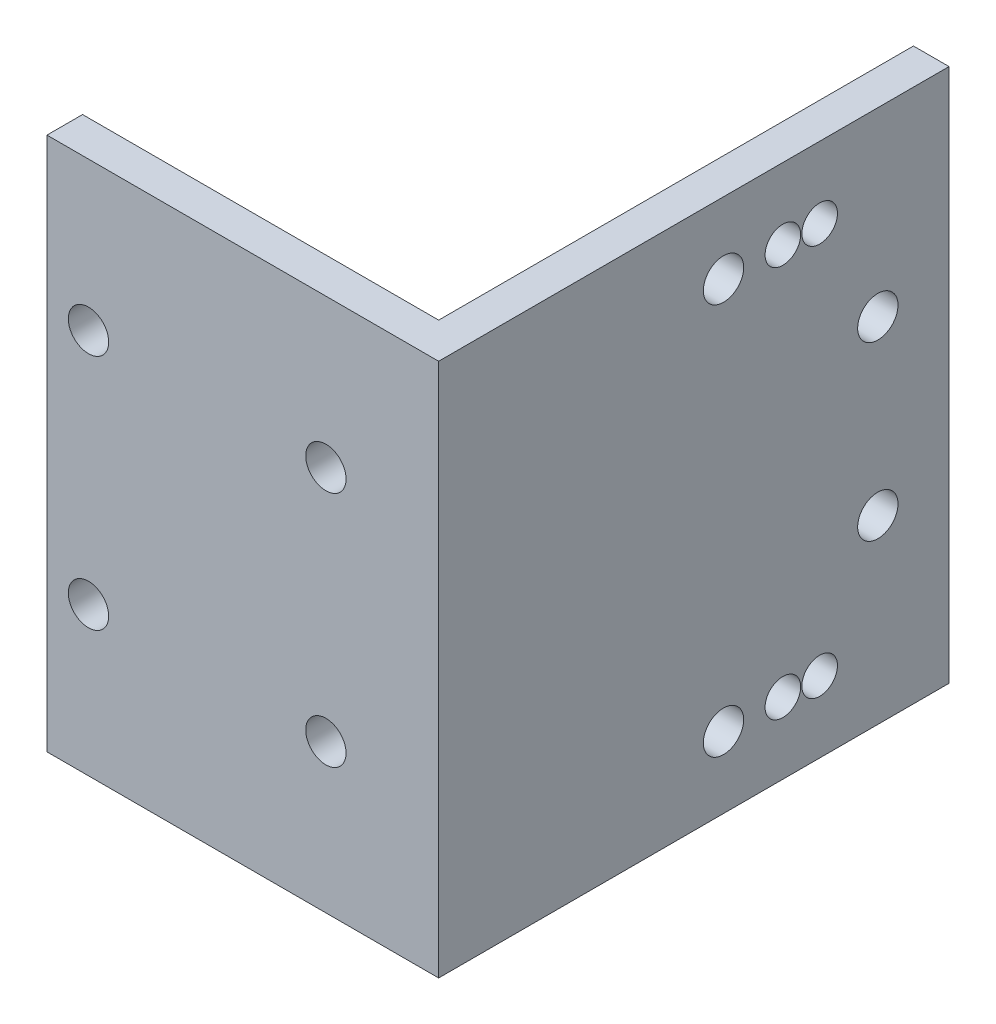
from build123d import *

# Parameters (mm, degrees)
EXTRUDE_1_DEPTH          = 45
CUT_EXTRUDE_1_REACH      = 86.161
SKETCH_2_R               = 1.7
CUT_EXTRUDE_2_REACH      = 83.939
SKETCH_3_R               = 1.7
SKETCH_3_R_2             = 1.5
CUT_EXTRUDE_3_DEPTH      = 81.777472107
CUT_EXTRUDE_3_DEPTH_BACK = 81.777472107


with BuildPart() as part:
    # 草图1 → 凸台-拉伸1 (new body)
    with BuildSketch(Plane(origin=(0, 0, 0), x_dir=(1, 0, 0), z_dir=(0, 1, 0))):
        Polygon((0, 0), (30, 0), (30, 60), (33, 60), (33, -3), (0, -3), align=None)
    extrude(amount=EXTRUDE_1_DEPTH)

    # 草图2 → 切除-拉伸1 (cut, up to next)
    with BuildSketch(Plane.XY.offset(3), mode=Mode.PRIVATE) as cut_extrude_1_sk1:
        with Locations((3.5, 32.5)):
            Circle(SKETCH_2_R)
    cut_extrude_1_tool1 = extrude(cut_extrude_1_sk1.sketch, amount=-CUT_EXTRUDE_1_REACH, mode=Mode.PRIVATE) & part.part
    # 草图2 → 切除-拉伸1 (cut, up to next)
    with BuildSketch(Plane.XY.offset(3), mode=Mode.PRIVATE) as cut_extrude_1_sk2:
        with Locations((23.5, 32.5)):
            Circle(SKETCH_2_R)
    cut_extrude_1_tool2 = extrude(cut_extrude_1_sk2.sketch, amount=-CUT_EXTRUDE_1_REACH, mode=Mode.PRIVATE) & part.part
    # 草图2 → 切除-拉伸1 (cut, up to next)
    with BuildSketch(Plane.XY.offset(3), mode=Mode.PRIVATE) as cut_extrude_1_sk3:
        with Locations((23.5, 12.5)):
            Circle(SKETCH_2_R)
    cut_extrude_1_tool3 = extrude(cut_extrude_1_sk3.sketch, amount=-CUT_EXTRUDE_1_REACH, mode=Mode.PRIVATE) & part.part
    # 草图2 → 切除-拉伸1 (cut, up to next)
    with BuildSketch(Plane.XY.offset(3), mode=Mode.PRIVATE) as cut_extrude_1_sk4:
        with Locations((3.5, 12.5)):
            Circle(SKETCH_2_R)
    cut_extrude_1_tool4 = extrude(cut_extrude_1_sk4.sketch, amount=-CUT_EXTRUDE_1_REACH, mode=Mode.PRIVATE) & part.part
    add(cut_extrude_1_tool1.solids().sort_by_distance((3.5, 32.5, 3))[0], mode=Mode.SUBTRACT)
    add(cut_extrude_1_tool2.solids().sort_by_distance((23.5, 32.5, 3))[0], mode=Mode.SUBTRACT)
    add(cut_extrude_1_tool3.solids().sort_by_distance((23.5, 12.5, 3))[0], mode=Mode.SUBTRACT)
    add(cut_extrude_1_tool4.solids().sort_by_distance((3.5, 12.5, 3))[0], mode=Mode.SUBTRACT)

    # 草图3 → 切除-拉伸2 (cut, up to next)
    with BuildSketch(Plane(origin=(33, 0, 0), x_dir=(0, 0, -1), z_dir=(1, 0, 0)), mode=Mode.PRIVATE) as cut_extrude_2_sk1:
        with Locations((21, 6)):
            Circle(SKETCH_3_R)
    cut_extrude_2_tool1 = extrude(cut_extrude_2_sk1.sketch, amount=-CUT_EXTRUDE_2_REACH, mode=Mode.PRIVATE) & part.part
    # 草图3 → 切除-拉伸2 (cut, up to next)
    with BuildSketch(Plane(origin=(33, 0, 0), x_dir=(0, 0, -1), z_dir=(1, 0, 0)), mode=Mode.PRIVATE) as cut_extrude_2_sk2:
        with Locations((21, 39)):
            Circle(SKETCH_3_R)
    cut_extrude_2_tool2 = extrude(cut_extrude_2_sk2.sketch, amount=-CUT_EXTRUDE_2_REACH, mode=Mode.PRIVATE) & part.part
    # 草图3 → 切除-拉伸2 (cut, up to next)
    with BuildSketch(Plane(origin=(33, 0, 0), x_dir=(0, 0, -1), z_dir=(1, 0, 0)), mode=Mode.PRIVATE) as cut_extrude_2_sk3:
        with Locations((34, 15.25)):
            Circle(SKETCH_3_R)
    cut_extrude_2_tool3 = extrude(cut_extrude_2_sk3.sketch, amount=-CUT_EXTRUDE_2_REACH, mode=Mode.PRIVATE) & part.part
    # 草图3 → 切除-拉伸2 (cut, up to next)
    with BuildSketch(Plane(origin=(33, 0, 0), x_dir=(0, 0, -1), z_dir=(1, 0, 0)), mode=Mode.PRIVATE) as cut_extrude_2_sk4:
        with Locations((34, 29.75)):
            Circle(SKETCH_3_R)
    cut_extrude_2_tool4 = extrude(cut_extrude_2_sk4.sketch, amount=-CUT_EXTRUDE_2_REACH, mode=Mode.PRIVATE) & part.part
    # 草图3 → 切除-拉伸2 (cut, up to next)
    with BuildSketch(Plane(origin=(33, 0, 0), x_dir=(0, 0, -1), z_dir=(1, 0, 0)), mode=Mode.PRIVATE) as cut_extrude_2_sk5:
        with Locations((26, 39)):
            Circle(SKETCH_3_R_2)
    cut_extrude_2_tool5 = extrude(cut_extrude_2_sk5.sketch, amount=-CUT_EXTRUDE_2_REACH, mode=Mode.PRIVATE) & part.part
    # 草图3 → 切除-拉伸2 (cut, up to next)
    with BuildSketch(Plane(origin=(33, 0, 0), x_dir=(0, 0, -1), z_dir=(1, 0, 0)), mode=Mode.PRIVATE) as cut_extrude_2_sk6:
        with Locations((29.1, 6)):
            Circle(SKETCH_3_R_2)
    cut_extrude_2_tool6 = extrude(cut_extrude_2_sk6.sketch, amount=-CUT_EXTRUDE_2_REACH, mode=Mode.PRIVATE) & part.part
    # 草图3 → 切除-拉伸2 (cut, up to next)
    with BuildSketch(Plane(origin=(33, 0, 0), x_dir=(0, 0, -1), z_dir=(1, 0, 0)), mode=Mode.PRIVATE) as cut_extrude_2_sk7:
        with Locations((29.1, 39)):
            Circle(SKETCH_3_R_2)
    cut_extrude_2_tool7 = extrude(cut_extrude_2_sk7.sketch, amount=-CUT_EXTRUDE_2_REACH, mode=Mode.PRIVATE) & part.part
    # 草图3 → 切除-拉伸2 (cut, up to next)
    with BuildSketch(Plane(origin=(33, 0, 0), x_dir=(0, 0, -1), z_dir=(1, 0, 0)), mode=Mode.PRIVATE) as cut_extrude_2_sk8:
        with Locations((26, 6)):
            Circle(SKETCH_3_R_2)
    cut_extrude_2_tool8 = extrude(cut_extrude_2_sk8.sketch, amount=-CUT_EXTRUDE_2_REACH, mode=Mode.PRIVATE) & part.part
    add(cut_extrude_2_tool1.solids().sort_by_distance((33, 6, -21))[0], mode=Mode.SUBTRACT)
    add(cut_extrude_2_tool2.solids().sort_by_distance((33, 39, -21))[0], mode=Mode.SUBTRACT)
    add(cut_extrude_2_tool3.solids().sort_by_distance((33, 15.25, -34))[0], mode=Mode.SUBTRACT)
    add(cut_extrude_2_tool4.solids().sort_by_distance((33, 29.75, -34))[0], mode=Mode.SUBTRACT)
    add(cut_extrude_2_tool5.solids().sort_by_distance((33, 39, -26))[0], mode=Mode.SUBTRACT)
    add(cut_extrude_2_tool6.solids().sort_by_distance((33, 6, -29.1))[0], mode=Mode.SUBTRACT)
    add(cut_extrude_2_tool7.solids().sort_by_distance((33, 39, -29.1))[0], mode=Mode.SUBTRACT)
    add(cut_extrude_2_tool8.solids().sort_by_distance((33, 6, -26))[0], mode=Mode.SUBTRACT)

    # 草图4 → 切除-拉伸3 (cut, two sides: drawn at the far end of the back side and taken through both)
    with BuildSketch(Plane.ZY.offset(-30).offset(-CUT_EXTRUDE_3_DEPTH_BACK)):
        Polygon((-40, 179.482930557), (-40, 45), (-40, 0), (-40, -134.482930557), (-308.965861114, -134.482930557), (-308.965861114, 179.482930557), align=None)
    extrude(amount=CUT_EXTRUDE_3_DEPTH + CUT_EXTRUDE_3_DEPTH_BACK, mode=Mode.SUBTRACT)


solid = part.part
